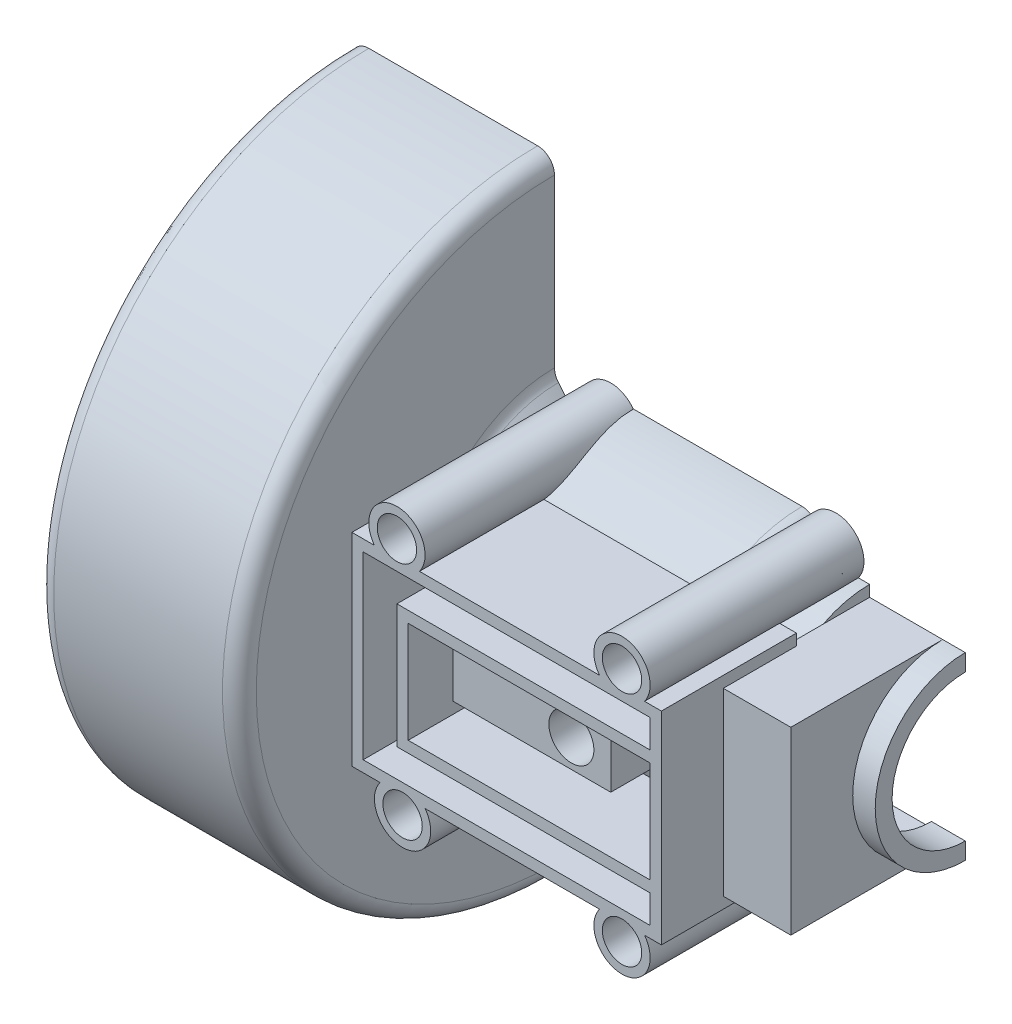
from build123d import *

# Parameters (mm, degrees)
BASE_R_VOLUTION_ANGLE   = 180
BOSS_EXTRU_1_DEPTH      = 11
BOSS_EXTRU_5_DEPTH      = 1
BOSS_EXTRU_6_START      = 2
BOSS_EXTRU_6_DEPTH      = 2
ESQUISSE5_W             = 55
ESQUISSE5_H             = 36
ESQUISSE5_W_2           = 43
ESQUISSE5_H_2           = 18
BOSS_EXTRU_7_DEPTH      = 24
ESQUISSE6_R             = 5
BOSS_EXTRU_8_DEPTH      = 38
ESQUISSE7_R             = 3.5
ENL_V_MAT_EXTRU_1_DEPTH = 129.300428712
ESQUISSE8_W             = 28
ESQUISSE8_H             = 10
ENL_V_MAT_EXTRU_5_DEPTH = 22
ESQUISSE9_W             = 28
ESQUISSE9_H             = 10
BOSS_EXTRU_11_DEPTH     = 10
ESQUISSE10_R            = 4
ENL_V_MAT_EXTRU_6_DEPTH = 127.653069471
ENL_V_START             = 30
ESQUISSE11_R            = 22
ENL_V_MAT_EXTRU_7_DEPTH = 30
ESQUISSE12_R            = 16
ENL_V_MAT_EXTRU_8_DEPTH = 8
BOSS_EXTRU_12_START     = 4
BOSS_EXTRU_12_DEPTH     = 4
ESQUISSE14_R            = 13
ENL_V_MAT_EXTRU_9_DEPTH = 10


with BuildPart() as part:
    # Esquisse1 → Base-Révolution (revolve)
    with BuildSketch(Plane.XY):
        with BuildLine():
            Line((55, 22), (85, 22))
            Line((85, 22), (85, 16))
            Line((85, 16), (94, 16))
            Line((94, 16), (94, 14))
            Line((94, 14), (96, 14))
            Line((96, 14), (96, 18))
            Line((96, 18), (89, 18))
            ThreePointArc((89, 18), (87.585786438, 18.585786438), (87, 20))
            Line((87, 20), (87, 21))
            ThreePointArc((87, 21), (86.121320344, 23.121320344), (84, 24))
            Line((84, 24), (54.08230613, 24))
            ThreePointArc((54.08230613, 24), (53.064227567, 23.821970241), (52.166981191, 23.309010693))
            Line((52.166981191, 23.309010693), (46.749972402, 18.815600568))
            ThreePointArc((46.749972402, 18.815600568), (44.559654735, 18.137241348), (42.529983625, 19.204058062))
            Line((42.529983625, 19.204058062), (40.695336161, 21.405635018))
            ThreePointArc((40.695336161, 21.405635018), (40.179185267, 22.304912426), (40, 23.326188217))
            Line((40, 23.326188217), (40, 53))
            ThreePointArc((40, 53), (39.121320344, 55.121320344), (37, 56))
            Line((37, 56), (7, 56))
            ThreePointArc((7, 56), (4.878679656, 55.121320344), (4, 53))
            Line((4, 53), (4, 16))
            ThreePointArc((4, 16), (3.707106781, 15.292893219), (3, 15))
            Line((3, 15), (1.5, 15))
            Line((1.5, 15), (1.5, 13))
            Line((1.5, 13), (3, 13))
            ThreePointArc((3, 13), (3.75, 13.75), (4.5, 13))
            Line((4.5, 13), (6, 13))
            Line((6, 13), (6, 51))
            ThreePointArc((6, 51), (6.878679656, 53.121320344), (9, 54))
            Line((9, 54), (35, 54))
            ThreePointArc((35, 54), (37.121320344, 53.121320344), (38, 51))
            Line((38, 51), (38, 22.602088347))
            ThreePointArc((38, 22.602088347), (38.179185267, 21.580812556), (38.695336161, 20.681535148))
            Line((38.695336161, 20.681535148), (44, 14.315938541))
            Line((44, 14.315938541), (44, 14))
            Line((44, 14), (46, 14))
            Line((46, 14), (46, 16))
            Line((46, 16), (55, 16))
            Line((55, 16), (55, 22))
        make_face()
    revolve(axis=Axis((-80, 0, 0), (1, 0, 0)), revolution_arc=BASE_R_VOLUTION_ANGLE)

    # Esquisse2 → Boss.-Extru.1 (add)
    with BuildSketch(Plane(origin=(96, 0, 0), x_dir=(0, 0, -1), z_dir=(1, 0, 0))):
        Polygon((0, 16), (-27, 16), (-27, -16), (0, -16), (0, -14), (-25, -14), (-25, 14), (0, 14), align=None)
    extrude(amount=BOSS_EXTRU_1_DEPTH)

    # Esquisse3 → Boss.-Extru.5 (add)
    with BuildSketch(Plane(origin=(96, 0, 0), x_dir=(0, 0, -1), z_dir=(1, 0, 0))):
        with BuildLine():
            Line((-25, 14), (-4, 14))
            ThreePointArc((-4, 14), (-14.560219779, 0), (-4, -14))
            Line((-4, -14), (-25, -14))
            Line((-25, -14), (-25, -6))
            Line((-25, -6), (-16.970562748, -6))
            Line((-16.970562748, -6), (-16.970562748, 6))
            Line((-16.970562748, 6), (-25, 6))
            Line((-25, 6), (-25, 14))
        make_face()
    extrude(amount=BOSS_EXTRU_5_DEPTH)

    # Esquisse4 → Boss.-Extru.6 (add)
    with BuildSketch(Plane(origin=(107, 0, 0), x_dir=(0, 0, -1), z_dir=(1, 0, 0)).offset(BOSS_EXTRU_6_START)):
        with BuildLine():
            Line((-27, -16), (0, -16))
            Line((0, -16), (0, -13))
            ThreePointArc((0, -13), (-13, 0), (0, 13))
            Line((0, 13), (0, 16))
            Line((0, 16), (-27, 16))
            Line((-27, 16), (-27, -16))
        make_face()
    extrude(amount=-BOSS_EXTRU_6_DEPTH)

    # Esquisse5 → Boss.-Extru.7 (add)
    with BuildSketch(Plane.XY.offset(38)):
        with Locations((69.5, 0)):
            Rectangle(ESQUISSE5_W, ESQUISSE5_H)
        Polygon((95, 16), (44, 16), (44, -16), (95, -16), (95, -11), (50, -11), (50, 11), (95, 11), align=None, mode=Mode.SUBTRACT)
        with Locations((73.5, 0)):
            Rectangle(ESQUISSE5_W_2, ESQUISSE5_H_2, mode=Mode.SUBTRACT)
    extrude(amount=-BOSS_EXTRU_7_DEPTH)

    # Esquisse6 → Boss.-Extru.8 (add)
    with BuildSketch(Plane.XY.offset(38)):
        with Locations((90, 21)):
            Circle(ESQUISSE6_R)
        with Locations((50, 21)):
            Circle(ESQUISSE6_R)
        with Locations((90, -21)):
            Circle(ESQUISSE6_R)
        with Locations((51, -21)):
            Circle(ESQUISSE6_R)
    extrude(amount=-BOSS_EXTRU_8_DEPTH)

    # Esquisse7 → Enlèv. mat.-Extru.1 (cut, through all)
    with BuildSketch(Plane.XY.offset(38)):
        with Locations((90, 21)):
            Circle(ESQUISSE7_R)
        with Locations((50, 21)):
            Circle(ESQUISSE7_R)
        with Locations((51, -21)):
            Circle(ESQUISSE7_R)
        with Locations((90, -21)):
            Circle(ESQUISSE7_R)
    extrude(amount=-ENL_V_MAT_EXTRU_1_DEPTH, mode=Mode.SUBTRACT)

    # Esquisse8 → Enlèv. mat.-Extru.5 (cut)
    with BuildSketch(Plane.XY):
        with Locations((68, 0)):
            Rectangle(ESQUISSE8_W, ESQUISSE8_H)
    extrude(amount=ENL_V_MAT_EXTRU_5_DEPTH, mode=Mode.SUBTRACT)

    # Esquisse9 → Boss.-Extru.11 (add)
    with BuildSketch(Plane(origin=(0, 0, 22), x_dir=(-1, 0, 0), z_dir=(0, 0, -1))):
        with Locations((-68, 0)):
            Rectangle(ESQUISSE9_W, ESQUISSE9_H)
    extrude(amount=-BOSS_EXTRU_11_DEPTH)

    # Esquisse10 → Enlèv. mat.-Extru.6 (cut, through all)
    with BuildSketch(Plane.XY.offset(32)):
        with Locations((75, 0)):
            Circle(ESQUISSE10_R)
    extrude(amount=-ENL_V_MAT_EXTRU_6_DEPTH, mode=Mode.SUBTRACT)

    # Esquisse11 → Enlèv. mat.-Extru.7 (cut)
    with BuildSketch(Plane(origin=(55, 0, 0), x_dir=(0, 0, -1), z_dir=(1, 0, 0)).offset(ENL_V_START)):
        Circle(ESQUISSE11_R)
    extrude(amount=-ENL_V_MAT_EXTRU_7_DEPTH, mode=Mode.SUBTRACT)

    # Esquisse12 → Enlèv. mat.-Extru.8 (cut)
    with BuildSketch(Plane(origin=(55, 0, 0), x_dir=(0, 0, -1), z_dir=(1, 0, 0))):
        Circle(ESQUISSE12_R)
    extrude(amount=-ENL_V_MAT_EXTRU_8_DEPTH, mode=Mode.SUBTRACT)

    # Esquisse13 → Boss.-Extru.12 (add)
    with BuildSketch(Plane(origin=(109, 0, 0), x_dir=(0, 0, -1), z_dir=(1, 0, 0)).offset(BOSS_EXTRU_12_START)):
        with BuildLine():
            Line((0, 16), (0, -16))
            ThreePointArc((0, -16), (-16, 0), (0, 16))
        make_face()
    extrude(amount=-BOSS_EXTRU_12_DEPTH)

    # Esquisse14 → Enlèv. mat.-Extru.9 (cut)
    with BuildSketch(Plane(origin=(113, 0, 0), x_dir=(0, 0, -1), z_dir=(1, 0, 0))):
        Circle(ESQUISSE14_R)
    extrude(amount=-ENL_V_MAT_EXTRU_9_DEPTH, mode=Mode.SUBTRACT)


solid = part.part
